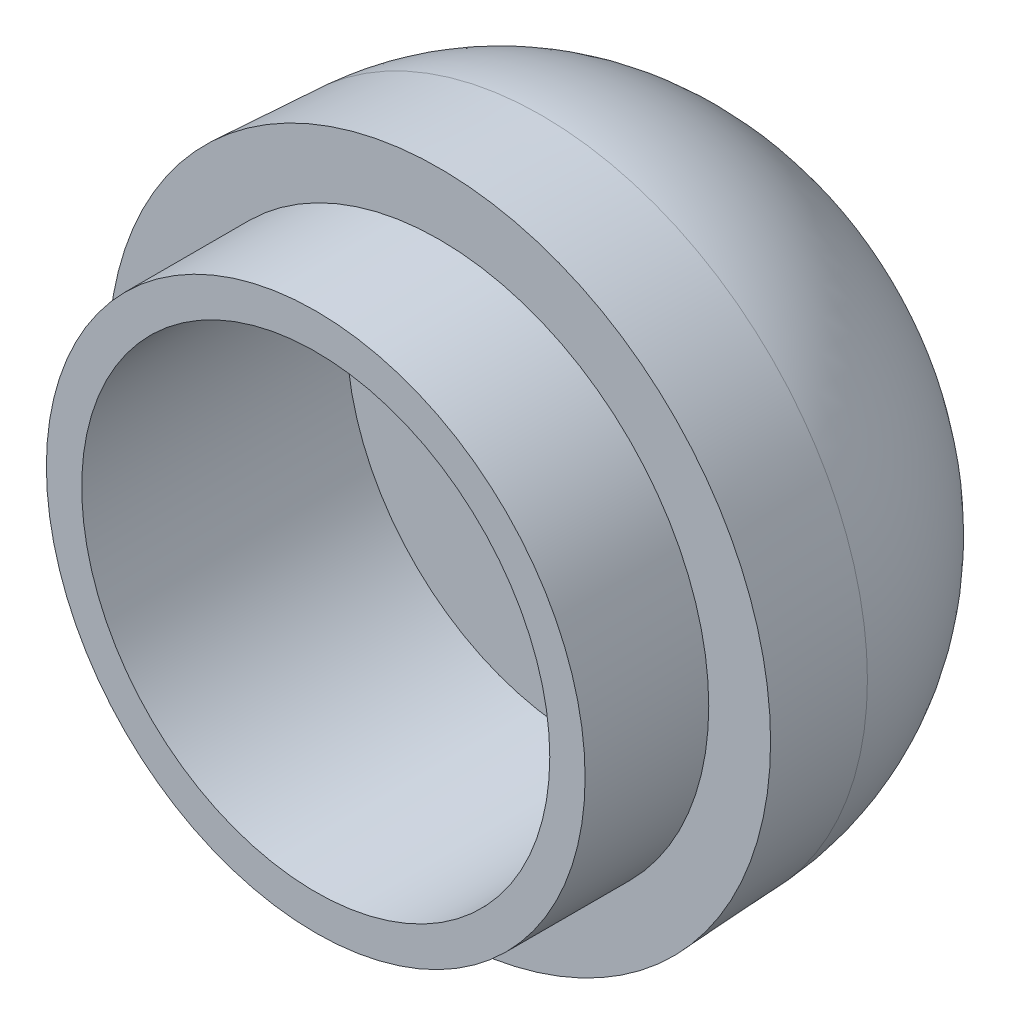
from build123d import *

# Parameters (mm, degrees)
SKETCH1_R           = 4.7625
BASE_EXTRUDE_DEPTH  = 5.08
BASE_EXTRUDE_DRAFT  = -3
FILLET3_R           = 3.81
SKETCH2_R           = 3.8735
BOSS_EXTRUDE1_DEPTH = 1.778
SKETCH3_R           = 3.3655
CUT_EXTRUDE1_DEPTH  = 3.81


with BuildPart() as part:
    # Sketch1 → Base-Extrude (with draft: the straight prism first)
    with BuildSketch(Plane.XY):
        Circle(SKETCH1_R)
    extrude(amount=-BASE_EXTRUDE_DEPTH)
    # Base-Extrude: the draft: its side faces are tilted about the plane it starts from
    base_extrude_sides = [part.faces().sort_by_distance(p)[0] for p in [
        (-4.7625, 0, -2.54),
    ]]
    draft(base_extrude_sides, Plane.XY, BASE_EXTRUDE_DRAFT)

    # Fillet3
    fillet3_edges = [part.edges().sort_by_distance(p)[0] for p in [
        (-4.496268481, 0, -5.08),
    ]]
    fillet(fillet3_edges, radius=FILLET3_R)

    # Sketch2 → Boss-Extrude1 (add)
    with BuildSketch(Plane.XY):
        Circle(SKETCH2_R)
    extrude(amount=BOSS_EXTRUDE1_DEPTH)

    # Sketch3 → Cut-Extrude1 (cut)
    with BuildSketch(Plane.XY.offset(1.778)):
        Circle(SKETCH3_R)
    extrude(amount=-CUT_EXTRUDE1_DEPTH, mode=Mode.SUBTRACT)


solid = part.part
